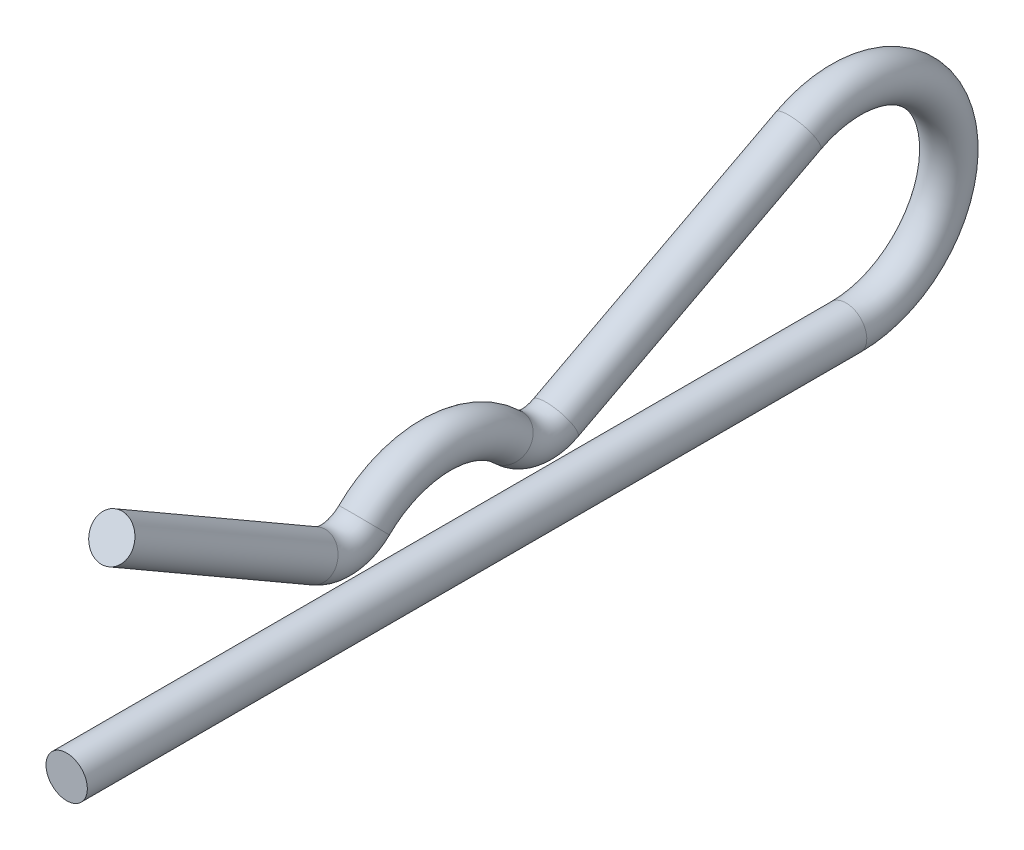
from build123d import *

# Parameters (mm, degrees)
SKETCH1_R = 0.8001


with BuildPart() as part:
    # Sweep1: sweep along a path in Sketch2
    with BuildLine(Plane(origin=(0, 0, 0), x_dir=(0, 0, -1), z_dir=(1, 0, 0))) as sweep1_path:
        Line((0, 0), (30.1498, 0))
        ThreePointArc((30.1498, 0), (34.009420782, 4.926282123), (28.302700663, 7.494992619))
        Line((28.302700663, 7.494992619), (18.916315959, 2.569392085))
        ThreePointArc((18.916315959, 2.569392085), (17.948121595, 2.404428196), (17.068166617, 2.840653653))
        ThreePointArc((17.068166617, 2.840653653), (14.2875, 3.9751), (11.506833383, 2.840653653))
        ThreePointArc((11.506833383, 2.840653653), (10.595153346, 2.400098126), (9.60259352, 2.600284671))
        Line((9.60259352, 2.600284671), (1.74625, 7.136146718))
    # Sketch1 → Sweep1 (sweep)
    with BuildSketch(Plane.XY):
        Circle(SKETCH1_R)
    sweep(path=sweep1_path.line)


solid = part.part
